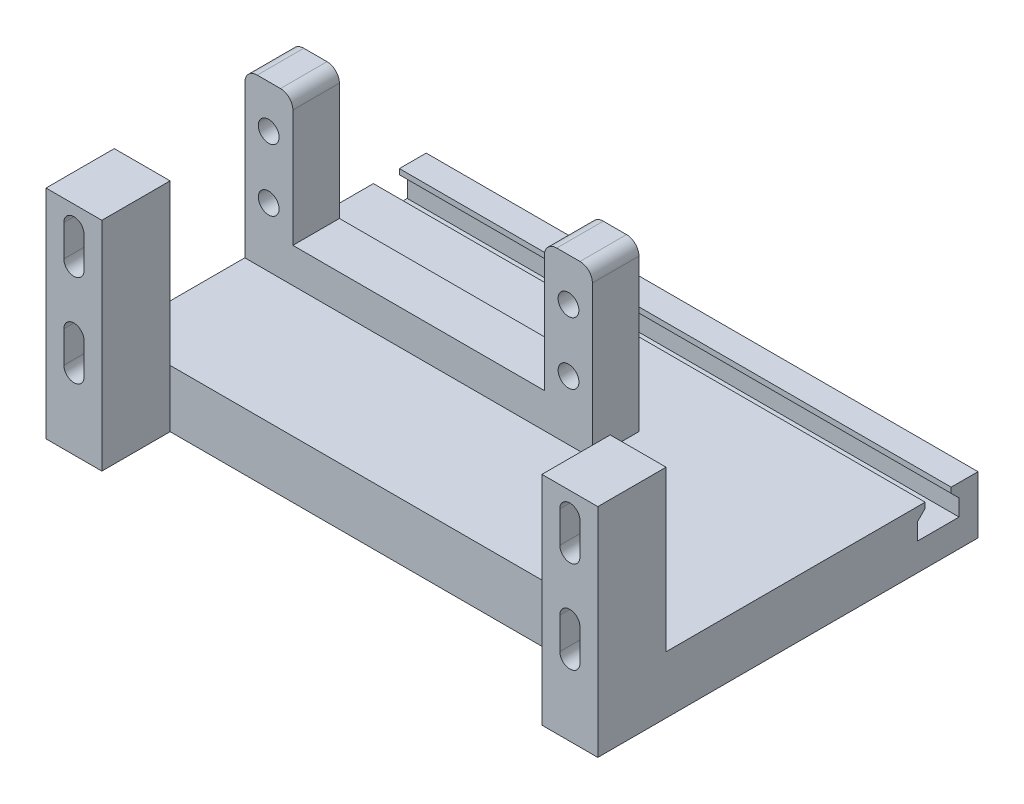
from build123d import *

# Parameters (mm, degrees)
SKETCH1_W           = 88.9
SKETCH1_H           = 39.25
BOSS_EXTRUDE1_DEPTH = 9.25
SKETCH2_W           = 56
SKETCH2_H           = 7.5
BOSS_EXTRUDE2_DEPTH = 26.49
SKETCH3_W           = 40.51
SKETCH3_H           = 20.88
CUT_EXTRUDE2_DEPTH  = 8.49
SKETCH5_R           = 1.675
CUT_EXTRUDE3_DEPTH  = 8.49
CUT_EXTRUDE4_DEPTH  = 91.49
FILLET1_R           = 2
FILLET2_R           = 2
SKETCH12_W          = 88.9
SKETCH12_H          = 9.25
BOSS_EXTRUDE3_DEPTH = 11
SKETCH16_W          = 9
SKETCH16_H          = 11
BOSS_EXTRUDE5_DEPTH = 35
CUT_EXTRUDE5_DEPTH  = 16
CUT_EXTRUDE6_DEPTH  = 16


with BuildPart() as part:
    # Sketch1 → Boss-Extrude1 (new body)
    with BuildSketch(Plane(origin=(0, 0, 0), x_dir=(1, 0, 0), z_dir=(0, 1, 0))):
        Rectangle(SKETCH1_W, SKETCH1_H)
    extrude(amount=BOSS_EXTRUDE1_DEPTH)

    # Sketch2 → Boss-Extrude2 (add)
    with BuildSketch(Plane(origin=(0, 9.25, 0), x_dir=(1, 0, 0), z_dir=(0, 1, 0))):
        with Locations((-16.45, -5.848195432)):
            Rectangle(SKETCH2_W, SKETCH2_H)
    extrude(amount=BOSS_EXTRUDE2_DEPTH)

    # Sketch3 → Cut-Extrude2 (cut)
    with BuildSketch(Plane.XY.offset(9.598195432)):
        with Locations((-16.45, 25.3)):
            Rectangle(SKETCH3_W, SKETCH3_H)
    extrude(amount=-CUT_EXTRUDE2_DEPTH, mode=Mode.SUBTRACT)

    # Sketch5 → Cut-Extrude3 (cut)
    with BuildSketch(Plane.XY.offset(9.598195432)):
        with Locations((-40.6, 18.82)):
            Circle(SKETCH5_R)
        with Locations((-40.6, 28.82)):
            Circle(SKETCH5_R)
        with Locations((7.7, 18.82)):
            Circle(SKETCH5_R)
        with Locations((7.7, 28.82)):
            Circle(SKETCH5_R)
    extrude(amount=-CUT_EXTRUDE3_DEPTH, mode=Mode.SUBTRACT)

    # Sketch10 → Cut-Extrude4 (cut)
    with BuildSketch(Plane.ZY.offset(44.45)):
        Polygon((-16.575, 4.44331134), (-9.845, 4.44331134), (-9.845, 7.11331134), (-11.117792206, 8.386103546), (-11.115, 9.25), (-15.305, 9.25), (-15.302207794, 8.386103546), (-16.575, 7.11331134), align=None)
    extrude(amount=-CUT_EXTRUDE4_DEPTH, mode=Mode.SUBTRACT)

    # Fillet1
    fillet1_edges = [part.edges().sort_by_distance(p)[0] for p in [
        (-44.45, 35.74, 5.848195432),
        (-36.705, 35.74, 5.848195432),
    ]]
    fillet(fillet1_edges, radius=FILLET1_R)

    # Fillet2
    fillet2_edges = [part.edges().sort_by_distance(p)[0] for p in [
        (11.55, 35.74, 5.848195432),
        (3.805, 35.74, 5.848195432),
    ]]
    fillet(fillet2_edges, radius=FILLET2_R)

    # Sketch12 → Boss-Extrude3 (add)
    with BuildSketch(Plane.XY.offset(19.625)):
        with Locations((0, 4.625)):
            Rectangle(SKETCH12_W, SKETCH12_H)
    extrude(amount=BOSS_EXTRUDE3_DEPTH)

    # Sketch16 → Boss-Extrude5 (add)
    with BuildSketch(Plane(origin=(0, 0, 0), x_dir=(1, 0, 0), z_dir=(0, 1, 0))):
        with Locations((39.95, -36.125)):
            Rectangle(SKETCH16_W, SKETCH16_H)
    boss_extrude5 = extrude(amount=BOSS_EXTRUDE5_DEPTH)

    # Sketch17 → Cut-Extrude5 (cut)
    with BuildSketch(Plane(origin=(0, 0, 30.625), x_dir=(-1, 0, 0), z_dir=(0, 0, -1))):
        with BuildLine():
            Line((-41.575, 11.71), (-41.575, 16.79))
            ThreePointArc((-41.575, 16.79), (-39.95, 18.415), (-38.325, 16.79))
            Line((-38.325, 16.79), (-38.325, 11.71))
            ThreePointArc((-38.325, 11.71), (-39.95, 10.085), (-41.575, 11.71))
        make_face()
    cut_extrude5 = extrude(amount=-CUT_EXTRUDE5_DEPTH, mode=Mode.SUBTRACT)

    # Sketch19 → Cut-Extrude6 (cut)
    with BuildSketch(Plane(origin=(0, 0, 30.625), x_dir=(-1, 0, 0), z_dir=(0, 0, -1))):
        with BuildLine():
            Line((-41.575, 26.546678497), (-41.575, 31.626678497))
            ThreePointArc((-41.575, 31.626678497), (-39.95, 33.251678497), (-38.325, 31.626678497))
            Line((-38.325, 31.626678497), (-38.325, 26.546678497))
            ThreePointArc((-38.325, 26.546678497), (-39.95, 24.921678497), (-41.575, 26.546678497))
        make_face()
    cut_extrude6 = extrude(amount=-CUT_EXTRUDE6_DEPTH, mode=Mode.SUBTRACT)

    # Mirror1: Boss-Extrude5, Cut-Extrude5, Cut-Extrude6 across plane
    add(boss_extrude5.mirror(Plane(origin=(0, 0, 0), x_dir=(0, 0, 1), z_dir=(1, 0, 0))))
    add(cut_extrude5.mirror(Plane(origin=(0, 0, 0), x_dir=(0, 0, 1), z_dir=(1, 0, 0))), mode=Mode.SUBTRACT)
    add(cut_extrude6.mirror(Plane(origin=(0, 0, 0), x_dir=(0, 0, 1), z_dir=(1, 0, 0))), mode=Mode.SUBTRACT)


solid = part.part
